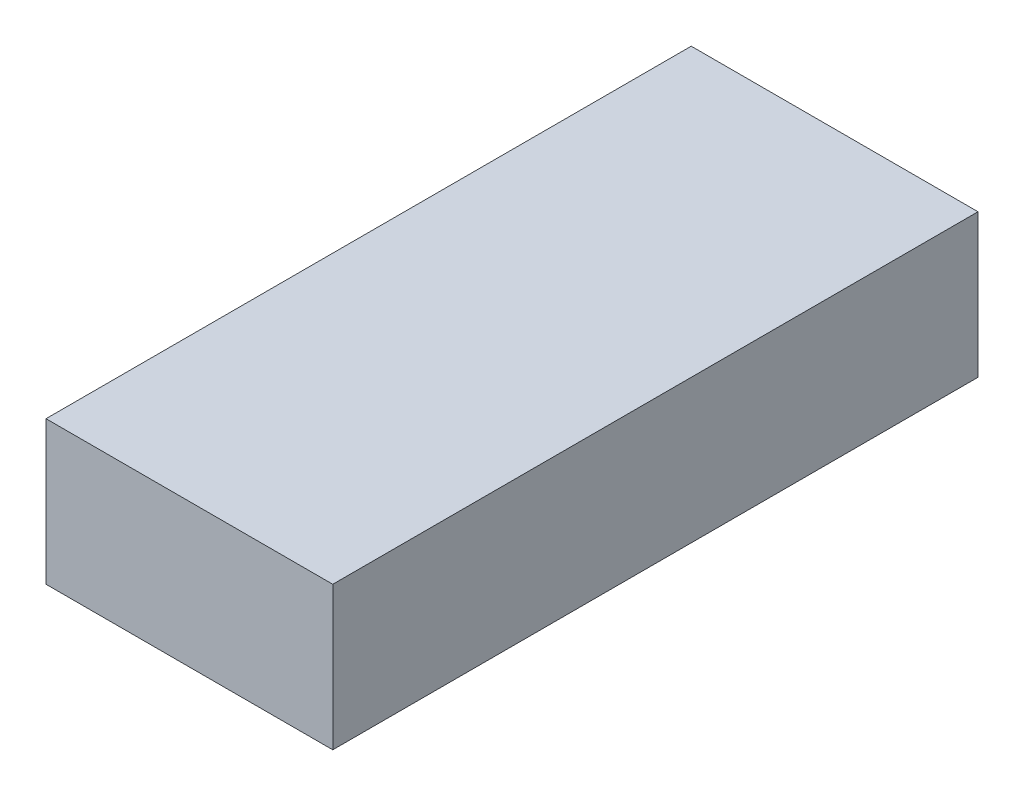
from build123d import *

# Parameters (mm, degrees)
SKETCH_1_W          = 800
SKETCH_1_H          = 400
EXTRUDE_1_DEPTH     = 1800
SKETCH_2_W          = 760
SKETCH_2_H          = 360
CUT_EXTRUDE_2_DEPTH = 50
SKETCH_3_W          = 380
SKETCH_3_H          = 20
EXTRUDE_2_DEPTH     = 1700
SKETCH_4_W          = 380
SKETCH_4_H          = 20
EXTRUDE_3_DEPTH     = 1700
SKETCH_5_W          = 760
SKETCH_5_H          = 20
EXTRUDE_4_DEPTH     = 300
SKETCH_6_R          = 20
EXTRUDE_5_DEPTH     = 80
SKETCH_7_R          = 20
EXTRUDE_6_DEPTH     = 80


with BuildPart() as part:
    # 草图1 → 凸台-拉伸1 (new body)
    with BuildSketch(Plane.XY):
        Rectangle(SKETCH_1_W, SKETCH_1_H)
    extrude(amount=EXTRUDE_1_DEPTH)

    # 草图2 → 切除-拉伸2 (cut)
    with BuildSketch(Plane.XY):
        Rectangle(SKETCH_2_W, SKETCH_2_H)
    extrude(amount=CUT_EXTRUDE_2_DEPTH, mode=Mode.SUBTRACT)

    # 草图3 → 凸台-拉伸2 (add)
    with BuildSketch(Plane.XY):
        with Locations((-190, 0)):
            Rectangle(SKETCH_3_W, SKETCH_3_H)
    extrude(amount=EXTRUDE_2_DEPTH)

    # 草图4 → 凸台-拉伸3 (add)
    with BuildSketch(Plane.XY):
        with Locations((190, 0)):
            Rectangle(SKETCH_4_W, SKETCH_4_H)
    extrude(amount=EXTRUDE_3_DEPTH)

    # 草图5 → 凸台-拉伸4 (add)
    with BuildSketch(Plane.XY):
        Rectangle(SKETCH_5_W, SKETCH_5_H)
    extrude(amount=EXTRUDE_4_DEPTH)

    # 草图6 → 凸台-拉伸5 (add)
    with BuildSketch(Plane.XY):
        with Locations((-150, 0)):
            Circle(SKETCH_6_R)
    extrude(amount=EXTRUDE_5_DEPTH)

    # 草图7 → 凸台-拉伸6 (add)
    with BuildSketch(Plane.XY):
        with Locations((150, 0)):
            Circle(SKETCH_7_R)
    extrude(amount=EXTRUDE_6_DEPTH)


solid = part.part
